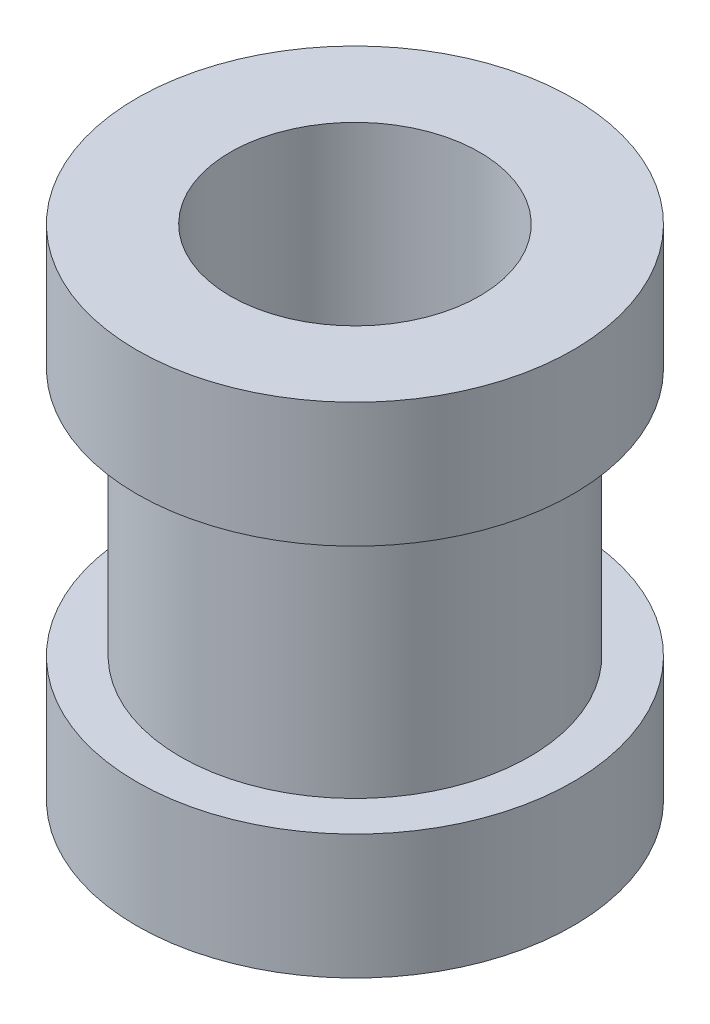
from build123d import *

# Parameters (mm, degrees)
SKETCH1_R               = 1.4
BOSS_EXTRUDE1_DEPTH     = 2
SKETCH2_R               = 1.75
BOSS_EXTRUDE2_DEPTH     = 1
CUT_EXTRUDE1_DEPTH      = 4.181980515
CUT_EXTRUDE1_DEPTH_BACK = 4.181980515
SKETCH3_R               = 1


with BuildPart() as part:
    # Sketch1 → Boss-Extrude1 (new, symmetric)
    with BuildSketch(Plane(origin=(0, 0, 0), x_dir=(1, 0, 0), z_dir=(0, 1, 0))):
        with Locations(Location((0, 0, 0), (0, 0, 270))):
            Circle(SKETCH1_R)
    extrude(amount=BOSS_EXTRUDE1_DEPTH, both=True)

    # Sketch2 → Boss-Extrude2 (add)
    with BuildSketch(Plane(origin=(0, 2, 0), x_dir=(1, 0, 0), z_dir=(0, 1, 0))):
        with Locations(Location((0, 0, 0), (0, 0, 270))):
            Circle(SKETCH2_R)
    boss_extrude2 = extrude(amount=-BOSS_EXTRUDE2_DEPTH)

    # Mirror1: Boss-Extrude2 across plane
    add(boss_extrude2.mirror(Plane.ZX))

    # Sketch3 → Cut-Extrude1 (cut, two sides: drawn at the far end of the back side and taken through both)
    with BuildSketch(Plane(origin=(0, 0, 0), x_dir=(1, 0, 0), z_dir=(0, 1, 0)).offset(-CUT_EXTRUDE1_DEPTH_BACK)):
        with Locations(Location((0, 0, 0), (0, 0, 270))):
            Circle(SKETCH3_R)
    extrude(amount=CUT_EXTRUDE1_DEPTH + CUT_EXTRUDE1_DEPTH_BACK, mode=Mode.SUBTRACT)


solid = part.part
